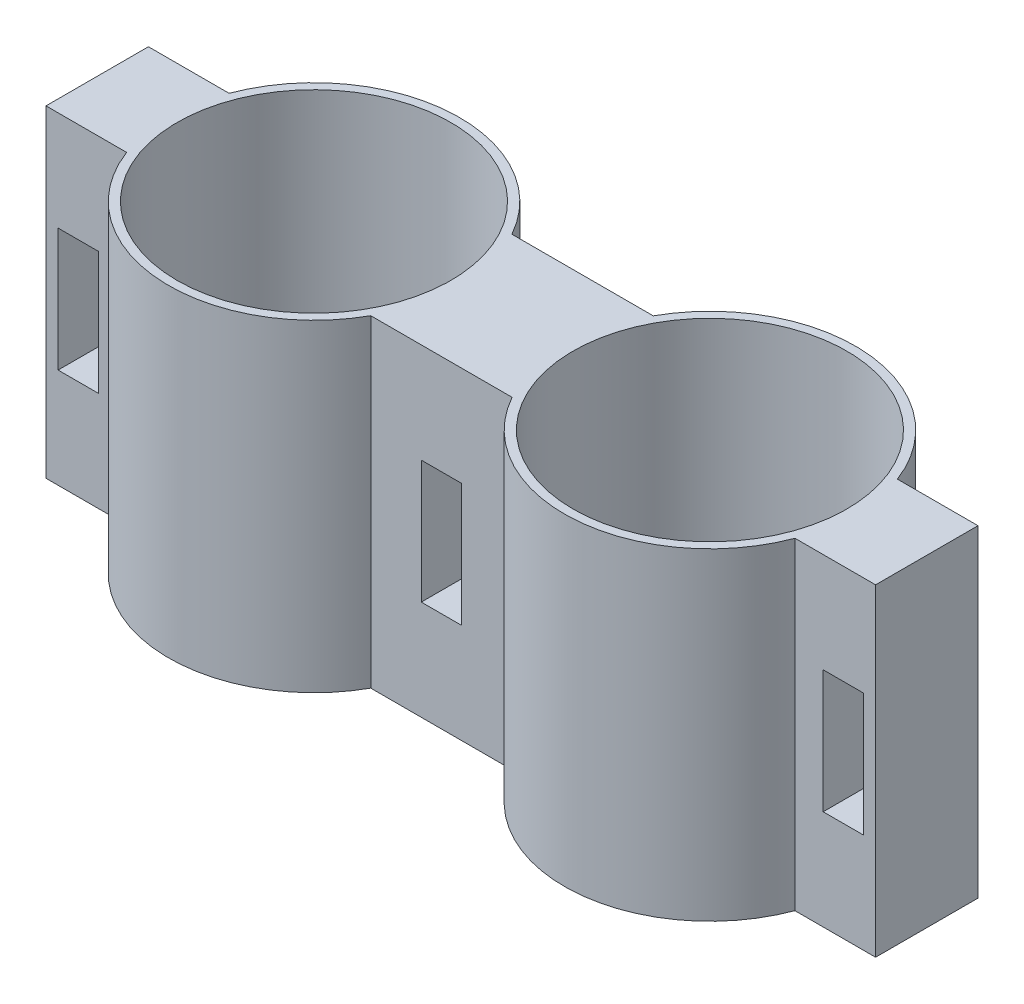
from build123d import *

# Parameters (mm, degrees)
SKETCH1_W               = 20
SKETCH1_H               = 25.4
BOSS_EXTRUDE1_DEPTH     = 80
SKETCH2_R               = 33.95
CUT_EXTRUDE1_DEPTH      = 80
CUT_EXTRUDE3_DEPTH      = 140.152703783
CUT_EXTRUDE3_DEPTH_BACK = 140.152703783
SKETCH3_W               = 10
SKETCH3_H               = 30.5


with BuildPart() as part:
    # Sketch1 → Boss-Extrude1 (new body)
    with BuildSketch(Plane(origin=(0, 0, 0), x_dir=(1, 0, 0), z_dir=(0, 1, 0))):
        with BuildLine():
            Line((-17.528898419, 17.5), (17.528898419, 17.5))
            ThreePointArc((17.528898419, 17.5), (85.182138113, 0), (17.528898419, -17.5))
            Line((17.528898419, -17.5), (-17.528898419, -17.5))
            ThreePointArc((-17.528898419, -17.5), (-85.182138113, 0), (-17.528898419, 17.5))
        make_face()
        with Locations((-92.873761816, 0)):
            Rectangle(SKETCH1_W, SKETCH1_H)
        with Locations((92.873761816, 0)):
            Rectangle(SKETCH1_W, SKETCH1_H)
    extrude(amount=BOSS_EXTRUDE1_DEPTH)

    # Sketch2 → Cut-Extrude1 (cut)
    with BuildSketch(Plane(origin=(0, 80, 0), x_dir=(1, 0, 0), z_dir=(0, 1, 0))):
        with Locations(Location((-49.108204523, 0, 0), (0, 0, 270))):
            Circle(SKETCH2_R)
        with Locations(Location((49.092138113, 0, 0), (0, 0, 270))):
            Circle(SKETCH2_R)
    extrude(amount=-CUT_EXTRUDE1_DEPTH, mode=Mode.SUBTRACT)

    # Sketch3 → Cut-Extrude3 (cut, two sides: drawn at the far end of the back side and taken through both)
    with BuildSketch(Plane.XY.offset(12.7).offset(-CUT_EXTRUDE3_DEPTH_BACK)):
        with Locations((0, 40)):
            Rectangle(SKETCH3_W, SKETCH3_H)
        with Locations((-94.873761816, 40)):
            Rectangle(SKETCH3_W, SKETCH3_H)
        with Locations((94.873761816, 40)):
            Rectangle(SKETCH3_W, SKETCH3_H)
    extrude(amount=CUT_EXTRUDE3_DEPTH + CUT_EXTRUDE3_DEPTH_BACK, mode=Mode.SUBTRACT)


solid = part.part
